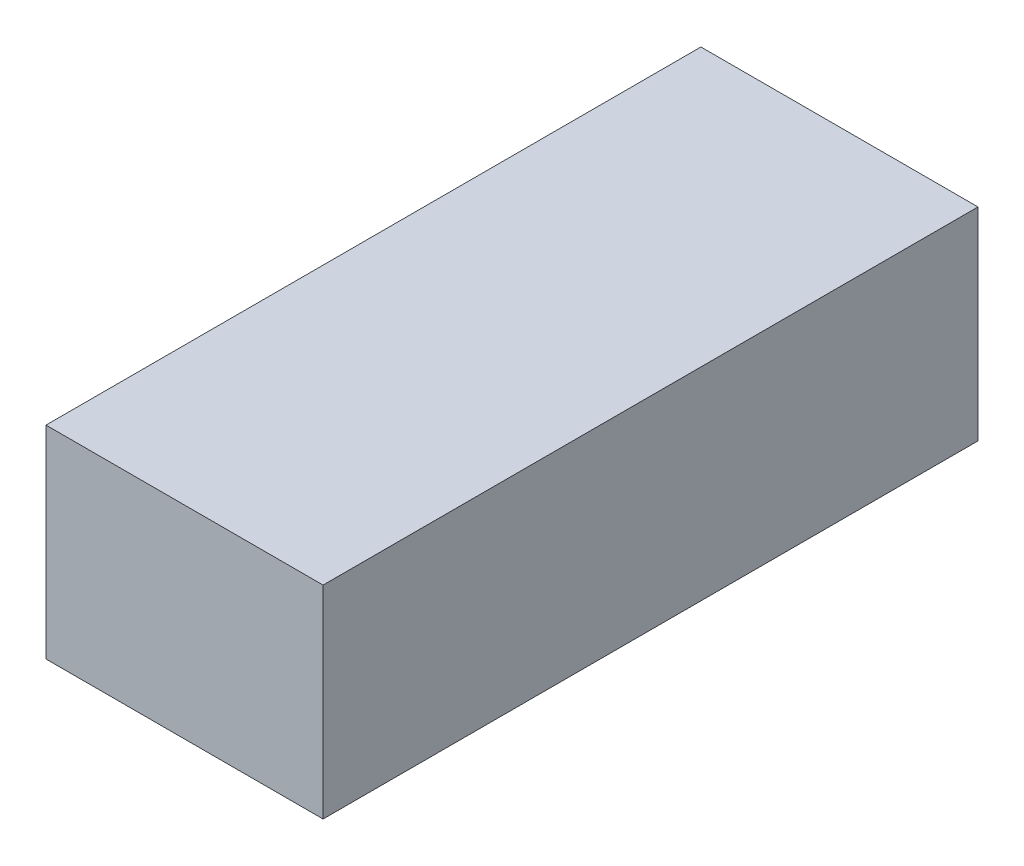
from build123d import *

# Parameters (mm, degrees)
SKETCH1_W           = 69.85
SKETCH1_H           = 165.1
BOSS_EXTRUDE1_DEPTH = 51.0794


with BuildPart() as part:
    # Sketch1 → Boss-Extrude1 (new body)
    with BuildSketch(Plane(origin=(0, 0, 0), x_dir=(1, 0, 0), z_dir=(0, 1, 0))):
        with Locations((0, 82.55)):
            Rectangle(SKETCH1_W, SKETCH1_H)
    extrude(amount=BOSS_EXTRUDE1_DEPTH)


solid = part.part
